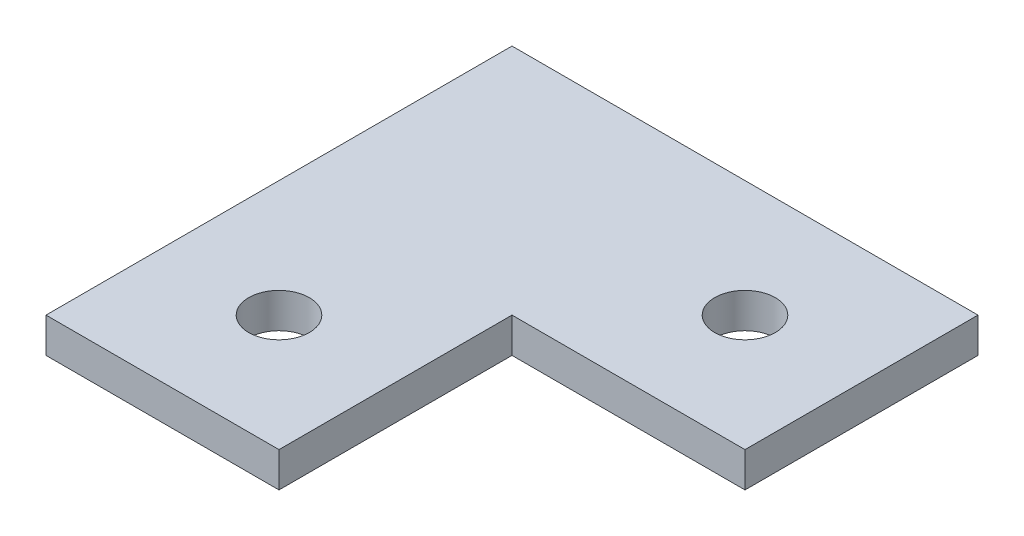
from build123d import *

# Parameters (mm, degrees)
SKETCH1_R           = 2.6
BOSS_EXTRUDE1_DEPTH = 3


with BuildPart() as part:
    # Sketch1 → Boss-Extrude1 (new body)
    with BuildSketch(Plane(origin=(0, 0, 0), x_dir=(1, 0, 0), z_dir=(0, 1, 0))):
        Polygon((-20, 20), (-20, -20), (0, -20), (0, 0), (20, 0), (20, 20), align=None)
        with Locations(Location((-10, -10, 0), (0, 0, 270))):
            Circle(SKETCH1_R, mode=Mode.SUBTRACT)
        with Locations(Location((10, 10, 0), (0, 0, 270))):
            Circle(SKETCH1_R, mode=Mode.SUBTRACT)
    extrude(amount=BOSS_EXTRUDE1_DEPTH)


solid = part.part
